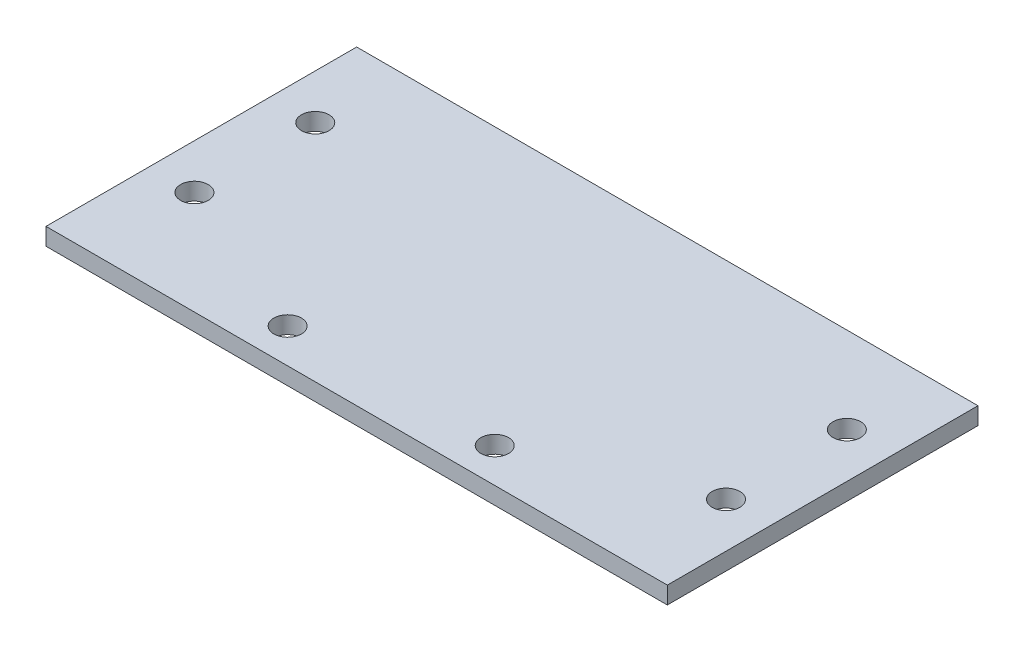
from build123d import *

# Parameters (mm, degrees)
SKETCH1_W           = 180
SKETCH1_H           = 90
SKETCH1_R           = 4
BOSS_EXTRUDE1_DEPTH = 2.5


with BuildPart() as part:
    # Sketch1 → Boss-Extrude1 (new, symmetric)
    with BuildSketch(Plane(origin=(0, 0, 0), x_dir=(1, 0, 0), z_dir=(0, 1, 0))):
        Rectangle(SKETCH1_W, SKETCH1_H)
        with Locations(Location((-77, 20, 0), (0, 0, 270))):
            Circle(SKETCH1_R, mode=Mode.SUBTRACT)
        with Locations(Location((-77, -15, 0), (0, 0, 270))):
            Circle(SKETCH1_R, mode=Mode.SUBTRACT)
        with Locations(Location((-30, -35, 0), (0, 0, 270))):
            Circle(SKETCH1_R, mode=Mode.SUBTRACT)
        with Locations(Location((30, -35, 0), (0, 0, 90))):
            Circle(SKETCH1_R, mode=Mode.SUBTRACT)
        with Locations(Location((77, 20, 0), (0, 0, 90))):
            Circle(SKETCH1_R, mode=Mode.SUBTRACT)
        with Locations(Location((77, -15, 0), (0, 0, 90))):
            Circle(SKETCH1_R, mode=Mode.SUBTRACT)
    extrude(amount=BOSS_EXTRUDE1_DEPTH, both=True)


solid = part.part
